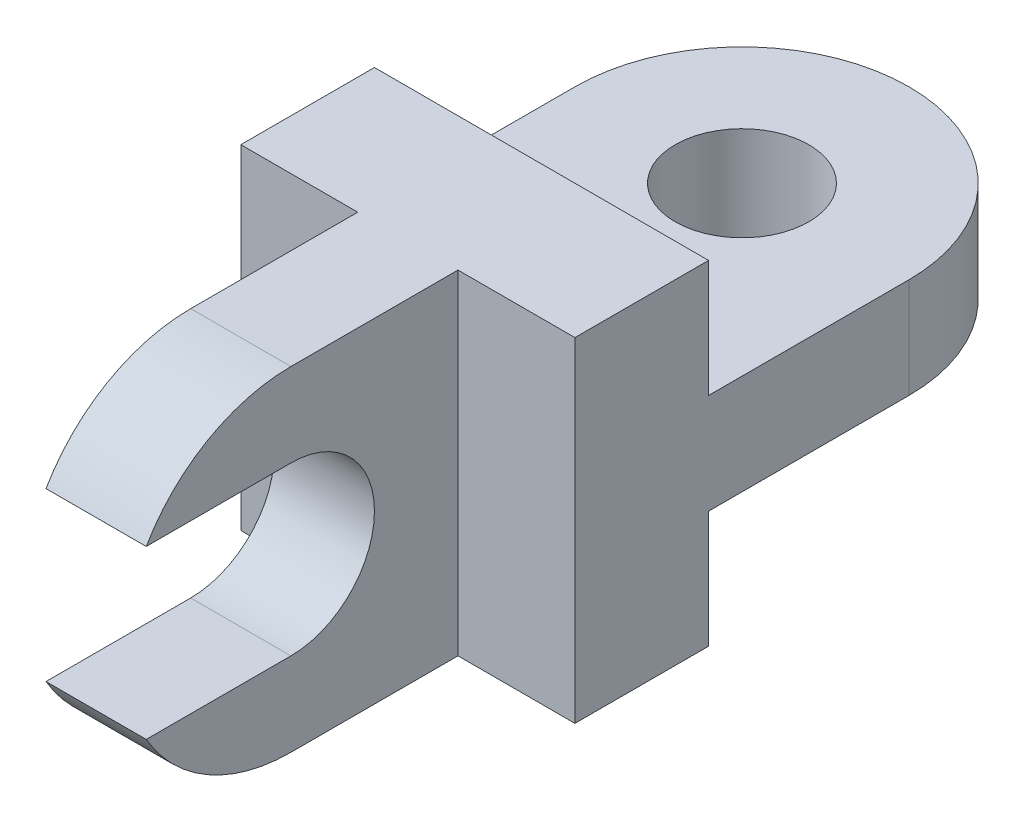
from build123d import *

# Parameters (mm, degrees)
SKETCH1_R           = 20
BOSS_EXTRUDE1_DEPTH = 15
BOSS_EXTRUDE2_DEPTH = 50
CUT_EXTRUDE1_DEPTH  = 210.975927192


with BuildPart() as part:
    # Sketch1 → Boss-Extrude1 (new, symmetric)
    with BuildSketch(Plane(origin=(0, 0, 0), x_dir=(1, 0, 0), z_dir=(0, 1, 0))):
        with BuildLine():
            ThreePointArc((50, 0), (0, 50), (-50, 0))
            Line((-50, 0), (-50, -60))
            Line((-50, -60), (50, -60))
            Line((50, -60), (50, 0))
        make_face()
        Circle(SKETCH1_R, mode=Mode.SUBTRACT)
    extrude(amount=BOSS_EXTRUDE1_DEPTH, both=True)

    # Sketch1<3> → Boss-Extrude2 (add, symmetric)
    with BuildSketch(Plane(origin=(0, 0, 0), x_dir=(1, 0, 0), z_dir=(0, 1, 0))):
        Polygon((-50, -60), (-50, -100), (-15, -100), (-15, -193.3), (15, -193.3), (15, -100), (50, -100), (50, -60), align=None)
    extrude(amount=BOSS_EXTRUDE2_DEPTH, both=True)

    # Sketch2 → Cut-Extrude1 (cut, through all)
    with BuildSketch(Plane(origin=(15, 0, 0), x_dir=(0, 0, -1), z_dir=(1, 0, 0))):
        with BuildLine():
            ThreePointArc((-150, -25), (-125, 0), (-150, 25))
            Line((-150, 25), (-193.3, 25))
            Line((-193.3, 25), (-193.3, -25))
            Line((-193.3, -25), (-150, -25))
        make_face()
        with BuildLine():
            Line((-193.3, 50), (-193.3, 25.002199903))
            ThreePointArc((-193.3, 25.002199903), (-174.998900024, 43.301905242), (-150, 50))
            Line((-150, 50), (-193.3, 50))
        make_face()
        with BuildLine():
            ThreePointArc((-150, -50), (-174.998900024, -43.301905242), (-193.3, -25.002199903))
            Line((-193.3, -25.002199903), (-193.3, -50))
            Line((-193.3, -50), (-150, -50))
        make_face()
    extrude(amount=-CUT_EXTRUDE1_DEPTH, mode=Mode.SUBTRACT)


solid = part.part
